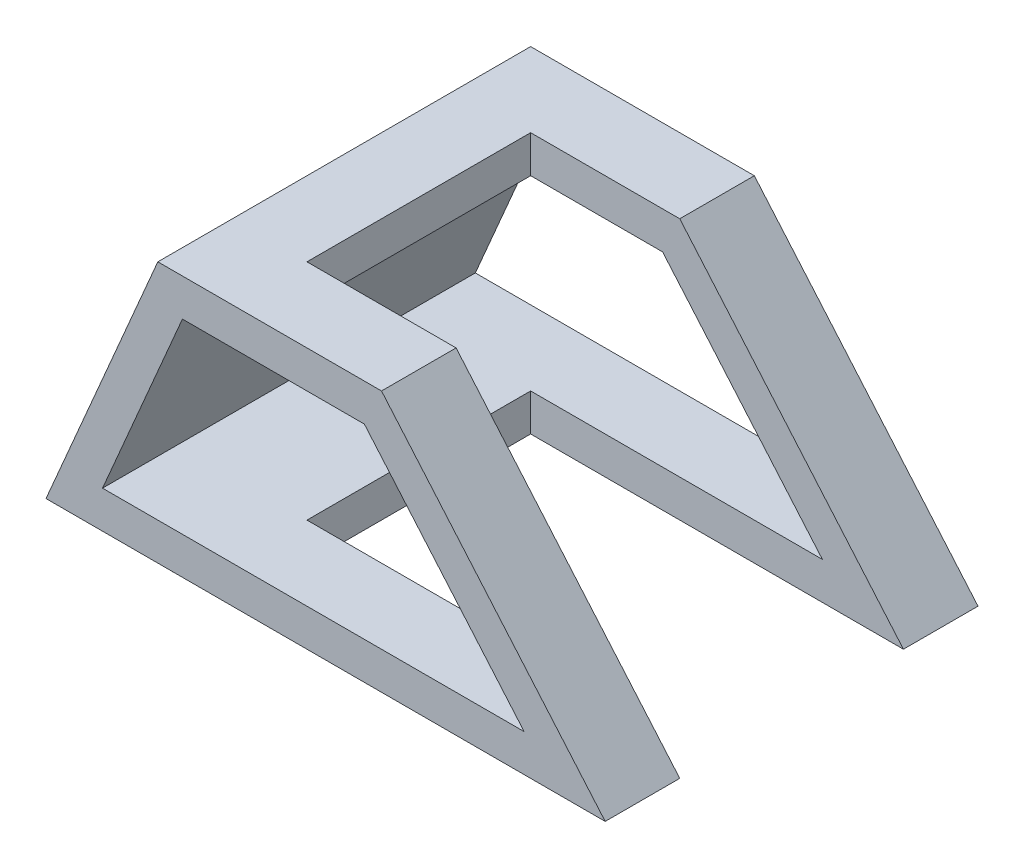
from build123d import *

# Parameters (mm, degrees)
BOSS_EXTRU_1_DEPTH      = 100
ENL_V_MAT_EXTRU_1_DEPTH = 100
ESQUISSE4_W             = 60
ESQUISSE4_H             = 92.195444573
ENL_V_MAT_EXTRU_7_DEPTH = 60
ESQUISSE6_W             = 40
ESQUISSE6_H             = 60
ENL_V_MAT_EXTRU_8_DEPTH = 120


with BuildPart() as part:
    # Esquisse1 → Boss.-Extru.1 (new body)
    with BuildSketch(Plane.XY):
        Polygon((0, 0), (60, 0), (120, -70), (-30, -70), align=None)
    extrude(amount=BOSS_EXTRU_1_DEPTH)

    # Esquisse2 → Enlèv. mat.-Extru.1 (cut)
    with BuildSketch(Plane.XY.offset(100)):
        Polygon((55.400650775, -10), (6.59396158, -10), (-14.834609849, -60), (98.257793632, -60), align=None)
    extrude(amount=-ENL_V_MAT_EXTRU_1_DEPTH, mode=Mode.SUBTRACT)

    # Esquisse4 → Enlèv. mat.-Extru.7 (cut)
    with BuildSketch(Plane(origin=(34.588235294, 29.647058824, 0), x_dir=(0, 0, -1), z_dir=(0.7592566023652965, 0.6507913734559686, 0))):
        with Locations((-50, -85.145204694)):
            Rectangle(ESQUISSE4_W, ESQUISSE4_H)
    extrude(amount=-ENL_V_MAT_EXTRU_7_DEPTH, mode=Mode.SUBTRACT)

    # Esquisse6 → Enlèv. mat.-Extru.8 (cut)
    with BuildSketch(Plane(origin=(0, 0, 0), x_dir=(1, 0, 0), z_dir=(0, 1, 0))):
        with Locations((40, -50)):
            Rectangle(ESQUISSE6_W, ESQUISSE6_H)
    extrude(amount=-ENL_V_MAT_EXTRU_8_DEPTH, mode=Mode.SUBTRACT)


solid = part.part
